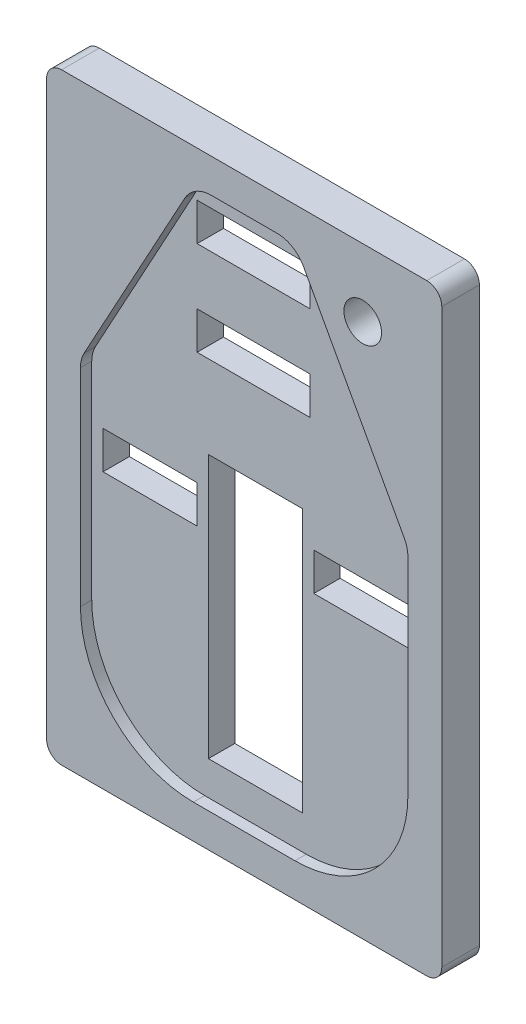
from build123d import *

# Parameters (mm, degrees)
BOSS_EXTRUDE1_DEPTH = 10
CUT_EXTRUDE1_DEPTH  = 3
SKETCH4_W           = 30
SKETCH4_H           = 10
SKETCH4_W_2         = 25
SKETCH4_H_2         = 70
CUT_EXTRUDE3_DEPTH  = 7
SKETCH5_R           = 5
CUT_EXTRUDE4_DEPTH  = 10


with BuildPart() as part:
    # Sketch1 → Boss-Extrude1 (new body)
    with BuildSketch(Plane.XY):
        with BuildLine():
            Line((-49.181793273, 56.913856582), (47.818206727, 56.913856582))
            ThreePointArc((47.818206727, 56.913856582), (50.646633852, 55.742283706), (51.818206727, 52.913856582))
            Line((51.818206727, 52.913856582), (51.818206727, -99.086143418))
            ThreePointArc((51.818206727, -99.086143418), (50.646633852, -101.914570543), (47.818206727, -103.086143418))
            Line((47.818206727, -103.086143418), (-49.181793273, -103.086143418))
            ThreePointArc((-49.181793273, -103.086143418), (-52.010220398, -101.914570543), (-53.181793273, -99.086143418))
            Line((-53.181793273, -99.086143418), (-53.181793273, 52.913856582))
            ThreePointArc((-53.181793273, 52.913856582), (-52.010220398, 55.742283706), (-49.181793273, 56.913856582))
        make_face()
    extrude(amount=BOSS_EXTRUDE1_DEPTH)

    # Sketch3 → Cut-Extrude1 (cut)
    with BuildSketch(Plane.XY.offset(10)):
        with BuildLine():
            Line((-9.432728483, 47.913856582), (8.069141937, 47.913856582))
            ThreePointArc((8.069141937, 47.913856582), (12.15285738, 46.793047536), (15.09230652, 43.744673627))
            Line((15.09230652, 43.744673627), (41.84137131, -5.295278488))
            ThreePointArc((41.84137131, -5.295278488), (42.570152182, -7.149395843), (42.818206727, -9.126095533))
            Line((42.818206727, -9.126095533), (42.818206727, -64.086143418))
            ThreePointArc((42.818206727, -64.086143418), (34.031410163, -85.299346854), (12.818206727, -94.086143418))
            Line((12.818206727, -94.086143418), (-14.181793273, -94.086143418))
            ThreePointArc((-14.181793273, -94.086143418), (-35.394996709, -85.299346854), (-44.181793273, -64.086143418))
            Line((-44.181793273, -64.086143418), (-44.181793273, -9.126095533))
            ThreePointArc((-44.181793273, -9.126095533), (-43.933738728, -7.149395843), (-43.204957856, -5.295278488))
            Line((-43.204957856, -5.295278488), (-16.455893066, 43.744673627))
            ThreePointArc((-16.455893066, 43.744673627), (-13.516443926, 46.793047536), (-9.432728483, 47.913856582))
        make_face()
    extrude(amount=-CUT_EXTRUDE1_DEPTH, mode=Mode.SUBTRACT)

    # Sketch4 → Cut-Extrude3 (cut)
    with BuildSketch(Plane.XY.offset(7)):
        with Locations((-1.181793273, 36.913856582)):
            Rectangle(SKETCH4_W, SKETCH4_H)
        with Locations((-1.181793273, 11.913856582)):
            Rectangle(SKETCH4_W, SKETCH4_H)
        with Locations((-28.681793273, -28.086143418)):
            Rectangle(SKETCH4_W_2, SKETCH4_H)
        with Locations((27.318206727, -28.086143418)):
            Rectangle(SKETCH4_W_2, SKETCH4_H)
        with Locations((-0.681793273, -50.086143418)):
            Rectangle(SKETCH4_W_2, SKETCH4_H_2)
    extrude(amount=-CUT_EXTRUDE3_DEPTH, mode=Mode.SUBTRACT)

    # Sketch5 → Cut-Extrude4 (cut)
    with BuildSketch(Plane.XY.offset(10)):
        with Locations((30.818206727, 38.913856582)):
            Circle(SKETCH5_R)
    extrude(amount=-CUT_EXTRUDE4_DEPTH, mode=Mode.SUBTRACT)


solid = part.part
